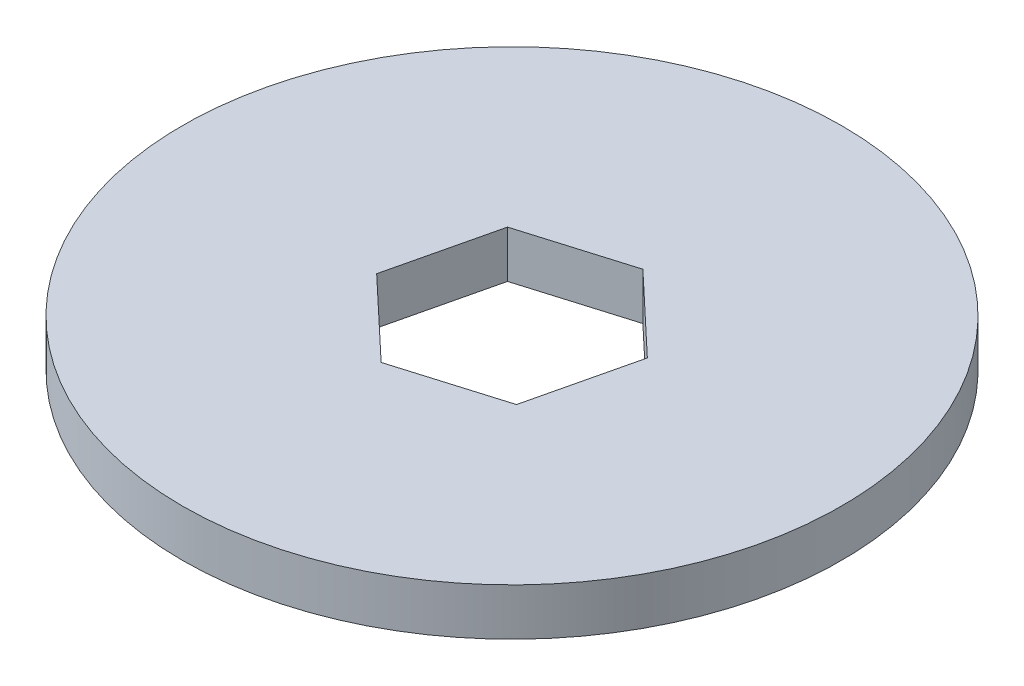
from build123d import *

# Parameters (mm, degrees)
SKETCH1_R           = 22.225
BOSS_EXTRUDE1_DEPTH = 3.175


with BuildPart() as part:
    # Sketch1 → Boss-Extrude1 (new body)
    with BuildSketch(Plane(origin=(0, 0, 0), x_dir=(1, 0, 0), z_dir=(0, 1, 0))):
        with Locations(Location((0, 0, 0), (0, 0, 270))):
            Circle(SKETCH1_R)
        Polygon((1.690652652, 7.134775886), (-5.333570841, 5.031536089), (-7.024223494, -2.103239797), (-1.690652652, -7.134775886), (5.333570841, -5.031536089), (7.024223494, 2.103239797), align=None, mode=Mode.SUBTRACT)
    extrude(amount=BOSS_EXTRUDE1_DEPTH)


solid = part.part
